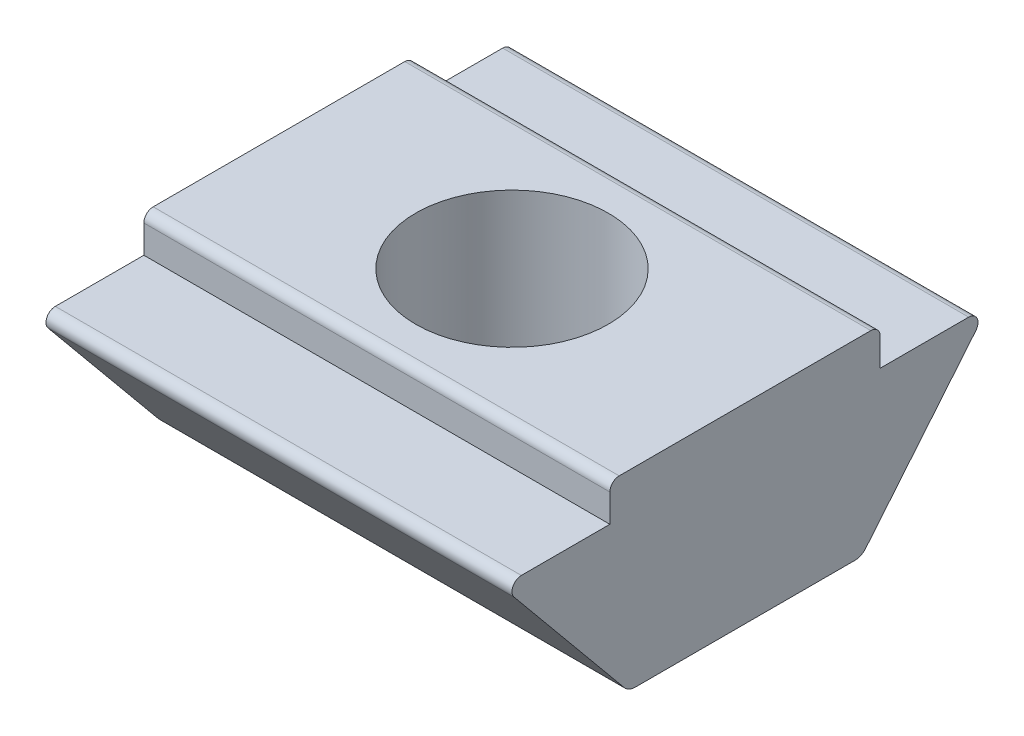
from build123d import *

# Parameters (mm, degrees)
BOSS_EXTRUDE1_DEPTH = 5
FILLET1_R           = 0.3
FILLET2_R           = 0.2
TAPPED_HOLE1_D      = 4.134


with BuildPart() as part:
    # Sketch1 → Boss-Extrude1 (new, symmetric)
    with BuildSketch(Plane(origin=(0, 0, 0), x_dir=(0, 0, -1), z_dir=(1, 0, 0))):
        with BuildLine():
            Line((2.5, -3.3), (-2.5, -3.3))
            Line((-2.5, -3.3), (-4.954229367, -0.327331466))
            ThreePointArc((-4.954229367, -0.327331466), (-4.980923041, -0.114754159), (-4.8, 0))
            Line((-4.8, 0), (-2.9, 0))
            Line((-2.9, 0), (-2.9, 0.8))
            Line((-2.9, 0.8), (2.9, 0.8))
            Line((2.9, 0.8), (2.9, 0))
            Line((2.9, 0), (4.8, 0))
            ThreePointArc((4.8, 0), (4.980923041, -0.114754159), (4.954229367, -0.327331466))
            Line((4.954229367, -0.327331466), (2.5, -3.3))
        make_face()
    extrude(amount=BOSS_EXTRUDE1_DEPTH, both=True)

    # Fillet1
    fillet1_edges = [part.edges().sort_by_distance(p)[0] for p in [
        (0, -3.3, -2.5),
        (0, -3.3, 2.5),
    ]]
    fillet(fillet1_edges, radius=FILLET1_R)

    # Fillet2
    fillet2_edges = [part.edges().sort_by_distance(p)[0] for p in [
        (0, 0.8, 2.9),
        (0, 0.8, -2.9),
    ]]
    fillet(fillet2_edges, radius=FILLET2_R)

    # Tapped Hole1 (through all)
    with Locations(Plane(origin=(0, 0.8, 0), x_dir=(1, 0, 0), z_dir=(0, 1, 0))):
        with Locations((0, 0)):
            Hole(TAPPED_HOLE1_D / 2)


solid = part.part
